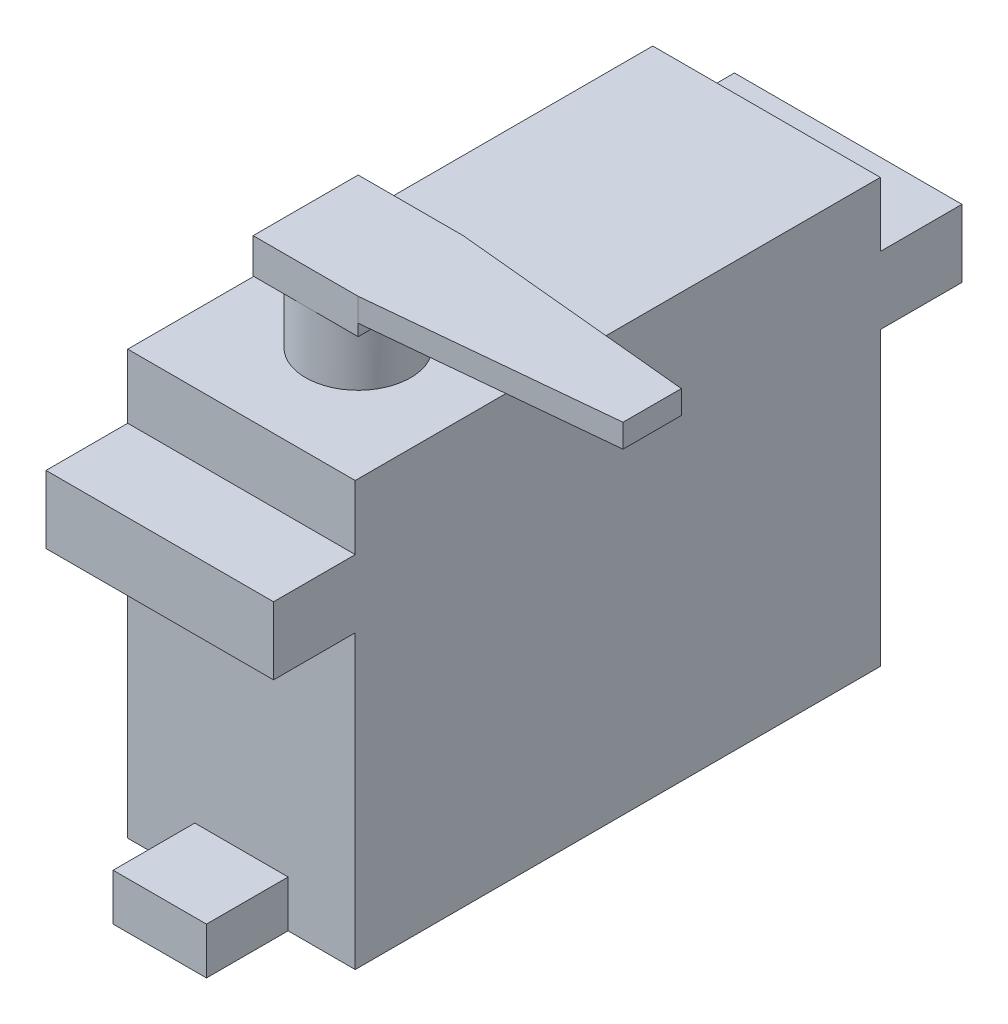
from build123d import *

# Parameters (mm, degrees)
BOSS_EXTRUDE1_DEPTH = 19.5
SKETCH2_W           = 8
SKETCH2_H           = 4
BOSS_EXTRUDE2_DEPTH = 7
SKETCH3_R           = 4.5
BOSS_EXTRUDE3_DEPTH = 5.3
SKETCH4_W           = 9
SKETCH4_H           = 9
BOSS_EXTRUDE4_DEPTH = 1
BOSS_EXTRUDE5_DEPTH = 2


with BuildPart() as part:
    # Sketch1 → Boss-Extrude1 (new body)
    with BuildSketch(Plane(origin=(0, 0, 0), x_dir=(0, 0, -1), z_dir=(1, 0, 0))):
        Polygon((0, 0), (45, 0), (45, 25), (52, 25), (52, 30.8), (45, 30.8), (45, 36.3), (0, 36.3), (0, 30.8), (-7, 30.8), (-7, 25), (0, 25), align=None)
    extrude(amount=BOSS_EXTRUDE1_DEPTH)

    # Sketch2 → Boss-Extrude2 (add)
    with BuildSketch(Plane.XY):
        with Locations((9.75, 2)):
            Rectangle(SKETCH2_W, SKETCH2_H)
    extrude(amount=BOSS_EXTRUDE2_DEPTH)

    # Sketch3 → Boss-Extrude3 (add)
    with BuildSketch(Plane(origin=(0, 36.3, 0), x_dir=(1, 0, 0), z_dir=(0, 1, 0))):
        with Locations(Location((9.75, 10, 0), (0, 0, 90))):
            Circle(SKETCH3_R)
    extrude(amount=BOSS_EXTRUDE3_DEPTH)

    # Sketch4 → Boss-Extrude4 (add)
    with BuildSketch(Plane(origin=(0, 41.6, 0), x_dir=(1, 0, 0), z_dir=(0, 1, 0))):
        with Locations((9.75, 10)):
            Rectangle(SKETCH4_W, SKETCH4_H)
    extrude(amount=BOSS_EXTRUDE4_DEPTH)

    # Sketch5 → Boss-Extrude5 (add)
    with BuildSketch(Plane(origin=(0, 42.6, 0), x_dir=(1, 0, 0), z_dir=(0, 1, 0))):
        Polygon((5.25, 14.5), (14.25, 14.5), (34.95, 12.5), (34.95, 10), (34.95, 7.5), (14.25, 5.5), (5.25, 5.5), align=None)
    extrude(amount=BOSS_EXTRUDE5_DEPTH)


solid = part.part
